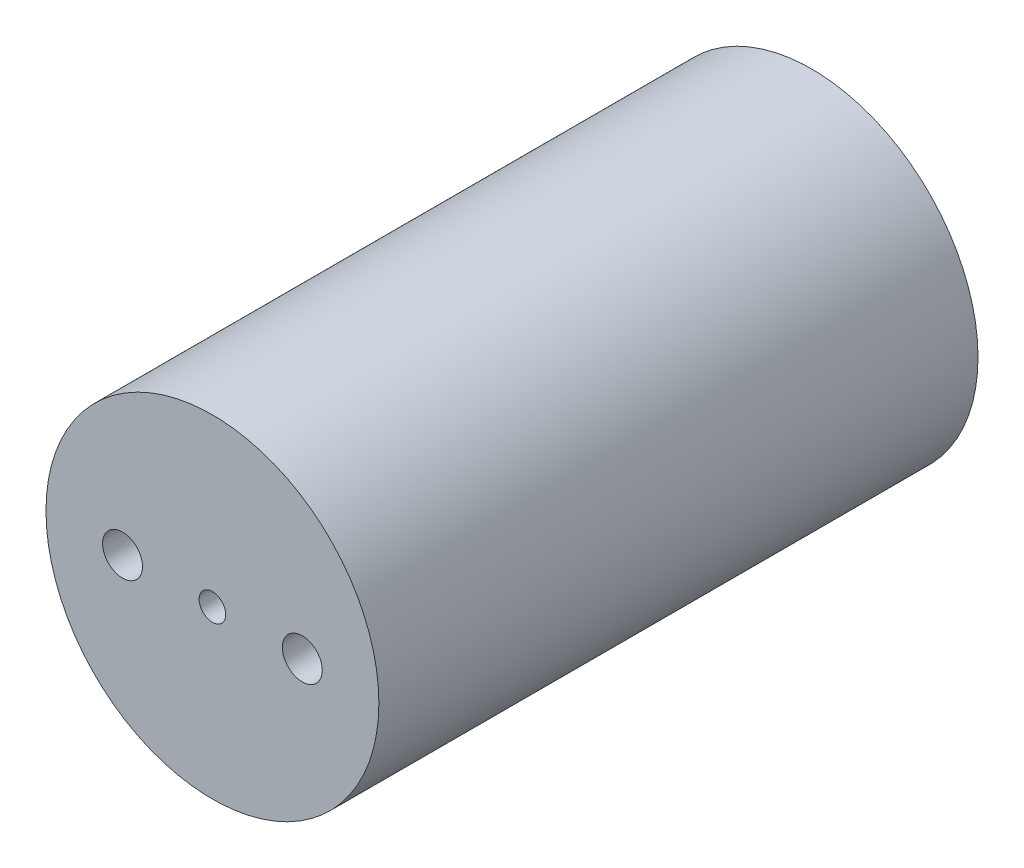
from build123d import *

# Parameters (mm, degrees)
SKETCH1_R           = 50
SKETCH1_R_2         = 4
BOSS_EXTRUDE1_DEPTH = 180
SKETCH2_R           = 6
CUT_EXTRUDE1_DEPTH  = 194.390796058


with BuildPart() as part:
    # Sketch1 → Boss-Extrude1 (new body)
    with BuildSketch(Plane.XY):
        with Locations(Location((0, 0, 0), (0, 0, 180))):
            Circle(SKETCH1_R)
        with Locations(Location((0, 0, 0), (0, 0, 180))):
            Circle(SKETCH1_R_2, mode=Mode.SUBTRACT)
    extrude(amount=BOSS_EXTRUDE1_DEPTH)

    # Sketch2 → Cut-Extrude1 (cut, through all)
    with BuildSketch(Plane.XY.offset(180)):
        with Locations((27, 0)):
            Circle(SKETCH2_R)
        with Locations((-27, 0)):
            Circle(SKETCH2_R)
    extrude(amount=-CUT_EXTRUDE1_DEPTH, mode=Mode.SUBTRACT)


solid = part.part
